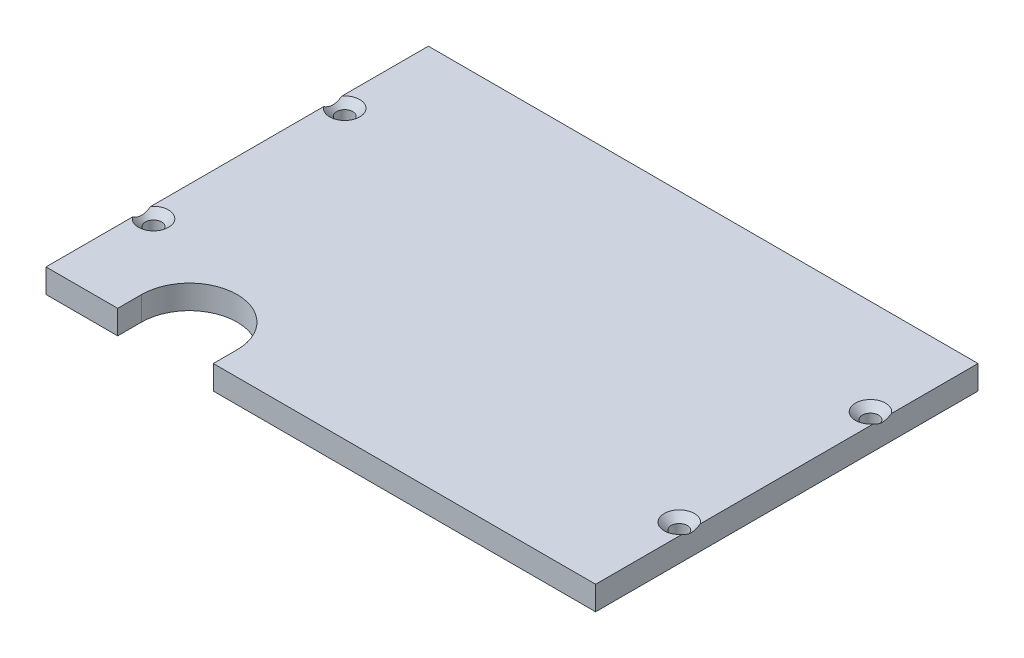
from build123d import *

# Parameters (mm, degrees)
BOSS_EXTRUDE1_DEPTH                                 = 5
CSK_FOR_M3_FLAT_COUNTERSUNK_HEAD_SCREW1_D           = 3.4
CSK_FOR_M3_FLAT_COUNTERSUNK_HEAD_SCREW1_CSINK_D     = 6.3
CSK_FOR_M3_FLAT_COUNTERSUNK_HEAD_SCREW1_CSINK_ANGLE = 90


with BuildPart() as part:
    # Sketch1 → Boss-Extrude1 (new body)
    with BuildSketch(Plane(origin=(0, 0, 0), x_dir=(1, 0, 0), z_dir=(0, 1, 0))):
        with BuildLine():
            Line((15, 5), (15, 0))
            Line((15, 0), (0, 0))
            Line((0, 0), (0, 80))
            Line((0, 80), (115, 80))
            Line((115, 80), (115, 0))
            Line((115, 0), (35, 0))
            Line((35, 0), (35, 5))
            ThreePointArc((35, 5), (25, 15), (15, 5))
        make_face()
    extrude(amount=-BOSS_EXTRUDE1_DEPTH)

    # CSK for M3 Flat Countersunk Head Screw1 (through all)
    with Locations(Plane(origin=(0, 0, 0), x_dir=(1, 0, 0), z_dir=(0, 1, 0))):
        with Locations((2.5, 60), (2.5, 20), (112.5, 60), (112.5, 20)):
            CounterSinkHole(CSK_FOR_M3_FLAT_COUNTERSUNK_HEAD_SCREW1_D / 2, CSK_FOR_M3_FLAT_COUNTERSUNK_HEAD_SCREW1_CSINK_D / 2, counter_sink_angle=CSK_FOR_M3_FLAT_COUNTERSUNK_HEAD_SCREW1_CSINK_ANGLE)


solid = part.part
